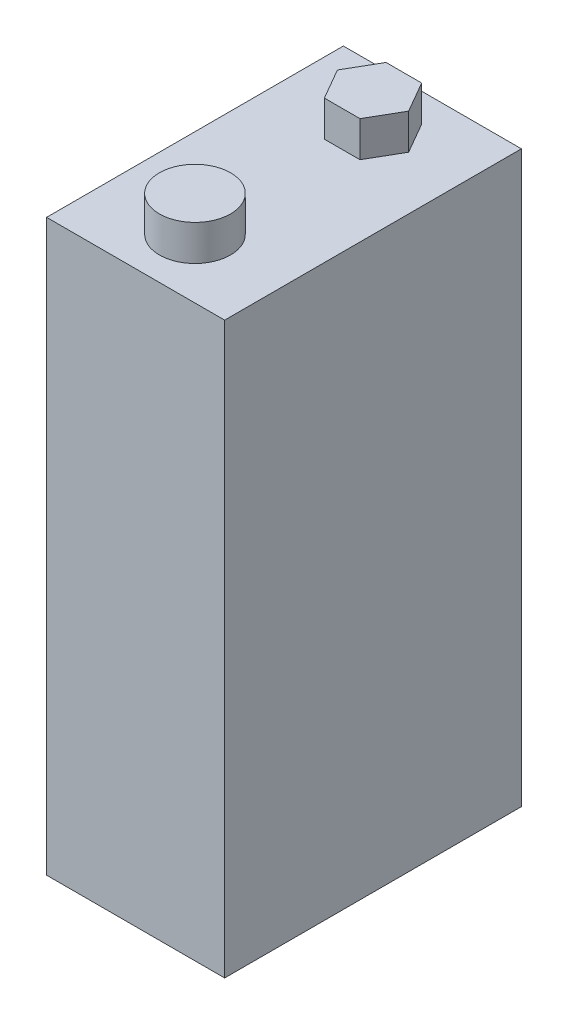
from build123d import *

# Parameters (mm, degrees)
SKETCH1_W           = 25
SKETCH1_H           = 48
BOSS_EXTRUDE1_DEPTH = 15
SKETCH2_R           = 3
BOSS_EXTRUDE2_DEPTH = 3


with BuildPart() as part:
    # Sketch1 → Boss-Extrude1 (new body)
    with BuildSketch(Plane(origin=(0, 0, 0), x_dir=(0, 0, -1), z_dir=(1, 0, 0))):
        with Locations((12.5, -24)):
            Rectangle(SKETCH1_W, SKETCH1_H)
    extrude(amount=BOSS_EXTRUDE1_DEPTH)

    # Sketch2 → Boss-Extrude2 (add)
    with BuildSketch(Plane(origin=(0, 0, 0), x_dir=(1, 0, 0), z_dir=(0, 1, 0))):
        with Locations(Location((7.5, 5, 0), (0, 0, 90))):
            Circle(SKETCH2_R)
        Polygon((4.5, 20), (6, 17.401923789), (9, 17.401923789), (10.5, 20), (9, 22.598076211), (6, 22.598076211), align=None)
    extrude(amount=BOSS_EXTRUDE2_DEPTH)


solid = part.part
